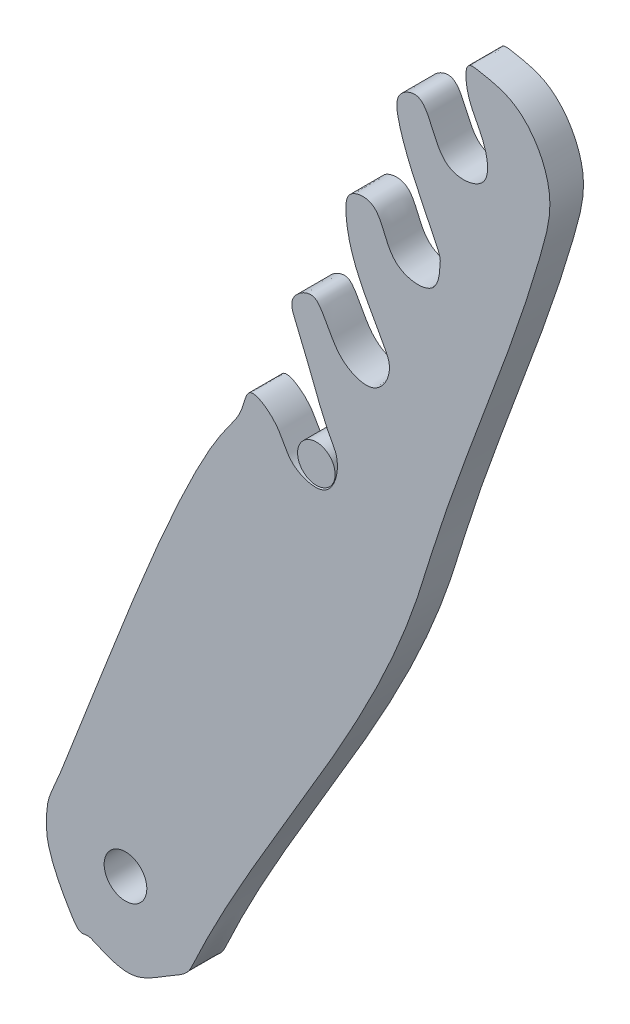
from build123d import *

# Parameters (mm, degrees)
SKETCH1_R             = 3.518166879
BOSS_EXTRUDE1_DEPTH   = 6.3
SKETCH1_R_2           = 4
BOSS_EXTRUDE1_2_DEPTH = 6.3


with BuildPart() as part:
    # Sketch1 → Boss-Extrude1 (new body)
    with BuildSketch(Plane.XY):
        with Locations((113.201419893, 171.821068421)):
            Circle(SKETCH1_R)
    extrude(amount=BOSS_EXTRUDE1_DEPTH)


with BuildPart() as body_2:
    # Sketch1 → Boss-Extrude1 2 (new body)
    with BuildSketch(Plane.XY):
        with BuildLine():
            add(Edge.make_bspline(
                [(67.025292766, 76.086360253), (62.796819533, 83.06962301), (62.294569823, 91.204671441), (67.252888781, 100.811046444), (87.535335438, 159.265539671), (99.597707637, 172.972580541), (100.057678776, 178.998741037), (106.700143177, 174.397801021), (107.763043339, 169.001560625), (116.16746878, 166.43970744), (117.814888455, 174.084790555), (114.268984852, 179.678529973), (111.431184665, 188.514325834), (107.605033633, 196.679039194), (112.290164886, 199.685686555), (115.452208441, 195.670697809), (116.829027642, 190.753603356), (124.65801271, 187.934307628), (127.676466784, 193.853796366), (123.378772805, 202.146630101), (118.654465214, 208.82214512), (118.655574844, 219.179728686), (125.845829838, 220.403590838), (125.594176605, 210.518746751), (135.998936685, 209.719832108), (136.367734621, 214.939235199), (136.529784175, 218.122849811), (129.133333787, 230.208832519), (127.838743831, 239.561223003), (134.631661144, 242.877027539), (134.792506719, 230.484064835), (146.006447512, 231.995345543), (144.886006629, 241.064200575), (141.033808091, 244.761389116), (141.239665641, 251.243065415), (145.562163364, 250.458936443), (152.397141673, 249.034503532), (158.315449918, 238.519105942), (151.312982603, 210.758883673), (139.978402557, 185.888736186), (124.618507741, 133.434174304), (102.563544691, 106.35928008), (89.036994962, 76.728904684), (84.882726749, 74.667637091), (79.282199886, 70.504007419), (74.371319916, 72.111744967), (69.501669681, 74.384983672), (69.149927629, 72.633793322), (67.229285813, 75.749468669), (67.025292766, 76.086360253)],
                knots=[0, 0, 0, 0, 0.01158918, 0.031534933, 0.180799467, 0.201843331, 0.223315504, 0.248897308, 0.276767215, 0.305437101, 0.337747448, 0.348183384, 0.409796463, 0.423218586, 0.440810374, 0.446640572, 0.476140578, 0.497606123, 0.519738701, 0.529174534, 0.600041468, 0.615012586, 0.627173679, 0.662700272, 0.687921214, 0.705245471, 0.709225453, 0.727721035, 0.732767544, 0.735476136, 0.746601131, 0.753315777, 0.759224936, 0.769159717, 0.772152256, 0.773875306, 0.780776934, 0.794743152, 0.804004845, 0.868230059, 0.879246806, 0.972315291, 0.973841665, 0.978189155, 0.986056903, 0.993573848, 0.994968158, 0.999440906, 1, 1, 1, 1], degree=3))
        make_face()
        with Locations((77.431042773, 86.941017553)):
            Circle(SKETCH1_R_2, mode=Mode.SUBTRACT)
    extrude(amount=BOSS_EXTRUDE1_2_DEPTH)


solid = Compound([part.part, body_2.part])
